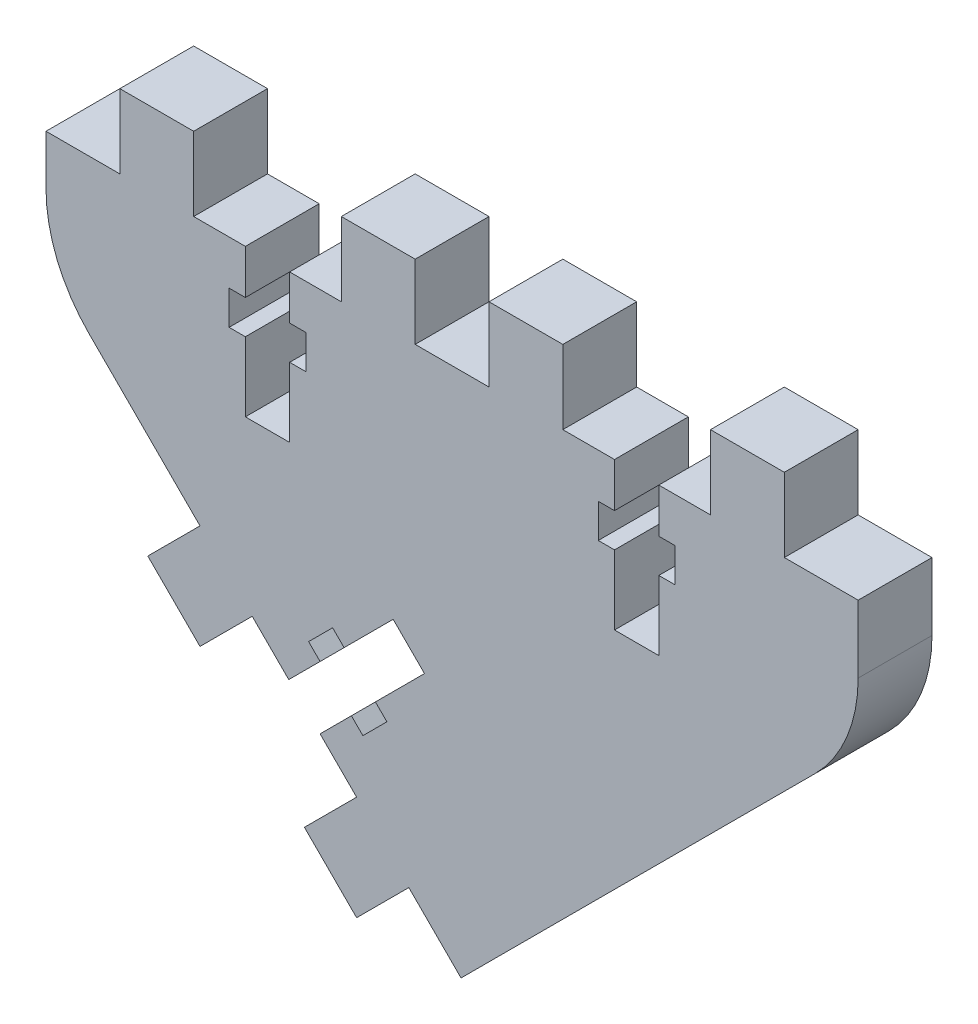
from build123d import *

# Parameters (mm, degrees)
BOSS_EXTRU_1_DEPTH = 5
CONG_1_R           = 10


with BuildPart() as part:
    # Esquisse1 → Boss.-Extru.1 (new body)
    with BuildSketch(Plane.XY):
        Polygon((-10.606601718, 10.606601718), (-7.071067812, 7.071067812), (-10.606601718, 3.535533906), (-7.071067812, 0), (-3.535533906, 3.535533906), (-1.060660172, 1.060660172), (1.060660172, 3.181980515), (0.282842712, 3.959797975), (1.909188309, 5.586143571), (2.687005769, 4.808326112), (6.01040764, 8.131727984), (8.131727984, 6.01040764), (4.808326112, 2.687005769), (5.586143571, 1.909188309), (3.959797975, 0.282842712), (3.181980515, 1.060660172), (1.060660172, -1.060660172), (3.535533906, -3.535533906), (0, -7.071067812), (3.535533906, -10.606601718), (7.071067812, -7.071067812), (10.606601718, -10.606601718), (37.5, 16.286796564), (37.5, 25), (32.5, 25), (32.5, 30), (27.5, 30), (27.5, 25), (24, 25), (24, 22), (25.1, 22), (25.1, 19.7), (24, 19.7), (24, 15), (21, 15), (21, 19.7), (19.9, 19.7), (19.9, 22), (21, 22), (21, 25), (17.5, 25), (17.5, 30), (12.5, 30), (12.5, 25), (7.5, 25), (7.5, 30), (2.5, 30), (2.5, 25), (-1, 25), (-1, 22), (0.1, 22), (0.1, 19.7), (-1, 19.7), (-1, 15), (-4, 15), (-4, 19.7), (-5.1, 19.7), (-5.1, 22), (-4, 22), (-4, 25), (-7.5, 25), (-7.5, 30), (-12.5, 30), (-12.5, 25), (-17.5, 25), (-17.5, 17.5), align=None)
    extrude(amount=BOSS_EXTRU_1_DEPTH)

    # Congé1
    cong_1_edges = [part.edges().sort_by_distance(p)[0] for p in [
        (37.5, 16.286796564, 2.5),
        (-17.5, 17.5, 2.5),
    ]]
    fillet(cong_1_edges, radius=CONG_1_R)


solid = part.part
